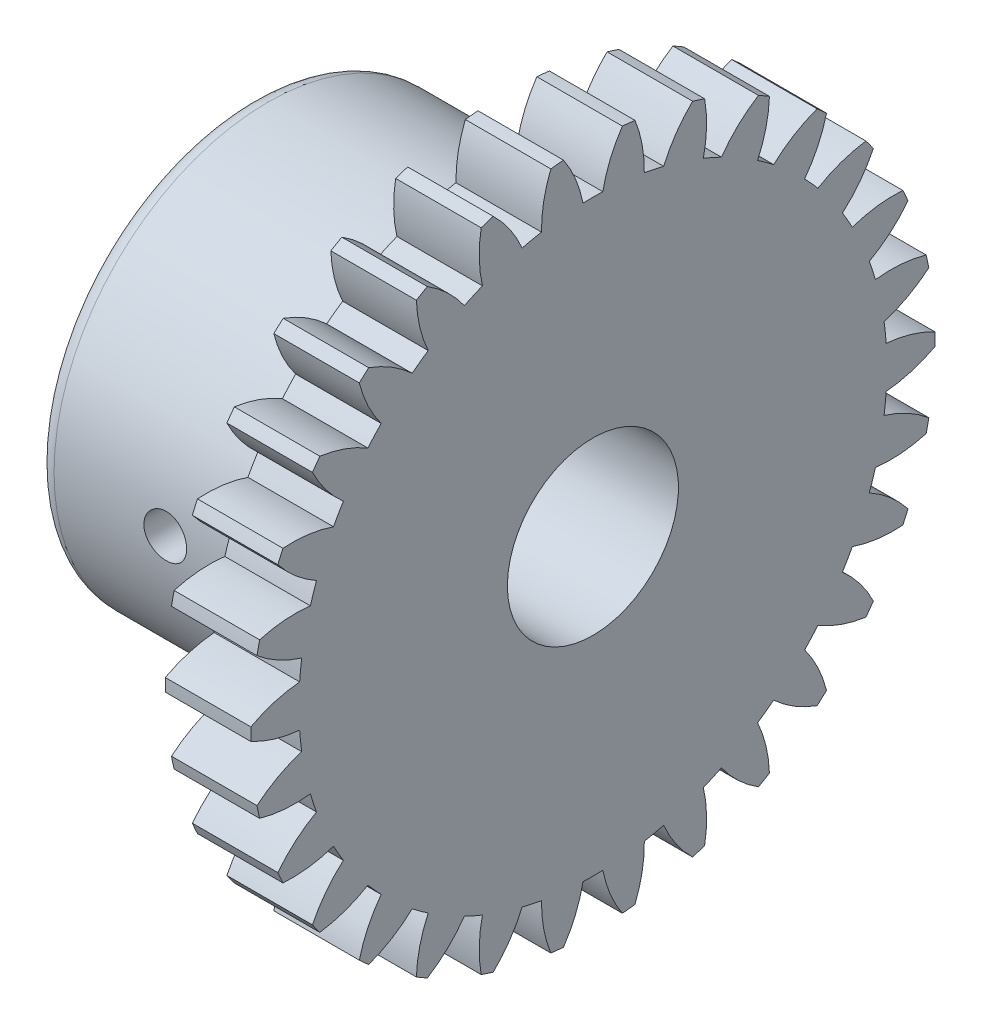
from build123d import *

# Parameters (mm, degrees)
BASPROSKE_W             = 6.35
BASPROSKE_H             = 25.4
TOOTHCUT_DEPTH          = 37.477972806
TEETHCUTS_COUNT         = 30
TEETHCUTS_ANGLE         = 348
HUBNEAONESKE_R          = 15.875
HUBNEARONE_DEPTH        = 19.0500508
BORSKE_R                = 6.35
BORE_DEPTH              = 25.4000508
CUT_EXTRUDE1_DEPTH      = 41.601023483
CUT_EXTRUDE1_DEPTH_BACK = 41.601023483
SKETCH1_R               = 1.5875
FILLET1_R               = 1.27


with BuildPart() as part:
    # BasProSke → Base-Revolve (revolve)
    with BuildSketch(Plane(origin=(0, 0, 0), x_dir=(1, 0, 0), z_dir=(0, 1, 0)), mode=Mode.PRIVATE) as base_revolve_sk:
        with Locations((3.175, 12.7)):
            Rectangle(BASPROSKE_W, BASPROSKE_H)
    revolve(base_revolve_sk.sketch.rotate(Axis((-10, 0, 0), (1, 0, 0)), 180), axis=Axis((-10, 0, 0), (1, 0, 0)))

    # TooCutSke → ToothCut (cut, through all)
    with BuildSketch(Plane(origin=(0, 0, 0), x_dir=(0, 0, -1), z_dir=(1, 0, 0))):
        with BuildLine():
            ThreePointArc((0.735377359, 21.814463535), (0, 21.826855), (-0.735377359, 21.814463535))
            ThreePointArc((-0.735377359, 21.814463535), (-1.291625993, 23.646238568), (-2.202933256, 25.329785831))
            ThreePointArc((-2.202933256, 25.329785831), (0, 25.4254), (2.202933256, 25.329785831))
            ThreePointArc((2.202933256, 25.329785831), (1.291625993, 23.646238568), (0.735377359, 21.814463535))
        make_face()
    toothcut = extrude(amount=TOOTHCUT_DEPTH, mode=Mode.SUBTRACT)

    # TeethCuts: ToothCut ×30 about axis
    teethcuts_axis = Axis((-10, 0, 0), (1, 0, 0))
    for i in range(1, TEETHCUTS_COUNT):
        add(toothcut.rotate(teethcuts_axis, i * TEETHCUTS_ANGLE / (TEETHCUTS_COUNT - 1)), mode=Mode.SUBTRACT)

    # HubNeaOneSke → HubNearOne (add)
    with BuildSketch(Plane.ZY):
        with Locations(Location((0, 0, 0), (0, 0, 180))):
            Circle(HUBNEAONESKE_R)
    extrude(amount=HUBNEARONE_DEPTH)

    # BorSke → Bore (cut, symmetric)
    with BuildSketch(Plane(origin=(0, 0, 0), x_dir=(0, 0, -1), z_dir=(1, 0, 0))):
        with Locations(Location((0, 0, 0), (0, 0, 180))):
            Circle(BORSKE_R)
    extrude(amount=BORE_DEPTH, both=True, mode=Mode.SUBTRACT)

    # Sketch1 → Cut-Extrude1 (cut, two sides: drawn at the far end of the back side and taken through both)
    with BuildSketch(Plane.XY.offset(-CUT_EXTRUDE1_DEPTH_BACK)):
        with Locations((-9.5250254, 0)):
            Circle(SKETCH1_R)
    extrude(amount=CUT_EXTRUDE1_DEPTH + CUT_EXTRUDE1_DEPTH_BACK, mode=Mode.SUBTRACT)

    # Fillet1
    fillet1_edges = [part.edges().sort_by_distance(p)[0] for p in [
        (0, 0, 15.875),
        (-19.0500508, 0, 15.875),
    ]]
    fillet(fillet1_edges, radius=FILLET1_R)


solid = part.part
